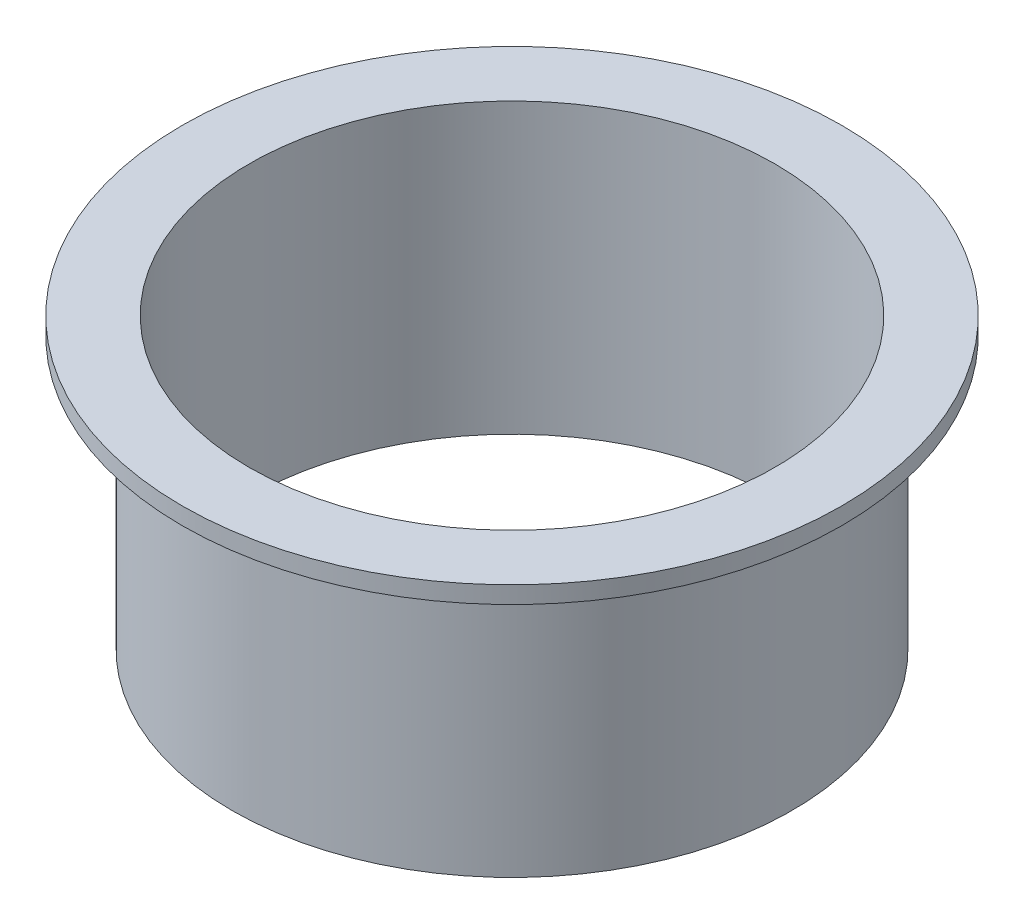
from build123d import *

# Parameters (mm, degrees)
SKETCH1_R           = 32.7
SKETCH1_R_2         = 30.7
BOSS_EXTRUDE1_DEPTH = 33.7
BOSS_EXTRUDE2_START = -2
SKETCH2_R           = 38.5
SKETCH2_R_2         = 30.7
BOSS_EXTRUDE2_DEPTH = 2


with BuildPart() as part:
    # Sketch1 → Boss-Extrude1 (new body)
    with BuildSketch(Plane(origin=(0, 0, 0), x_dir=(1, 0, 0), z_dir=(0, 1, 0))):
        with Locations(Location((0, 0, 0), (0, 0, 270))):
            Circle(SKETCH1_R)
        with Locations(Location((0, 0, 0), (0, 0, 270))):
            Circle(SKETCH1_R_2, mode=Mode.SUBTRACT)
    extrude(amount=BOSS_EXTRUDE1_DEPTH)

    # Sketch2 → Boss-Extrude2 (add)
    with BuildSketch(Plane(origin=(0, 33.7, 0), x_dir=(1, 0, 0), z_dir=(0, 1, 0)).offset(BOSS_EXTRUDE2_START)):
        with Locations(Location((0, 0, 0), (0, 0, 270))):
            Circle(SKETCH2_R)
        with Locations(Location((0, 0, 0), (0, 0, 270))):
            Circle(SKETCH2_R_2, mode=Mode.SUBTRACT)
    extrude(amount=BOSS_EXTRUDE2_DEPTH)


solid = part.part
